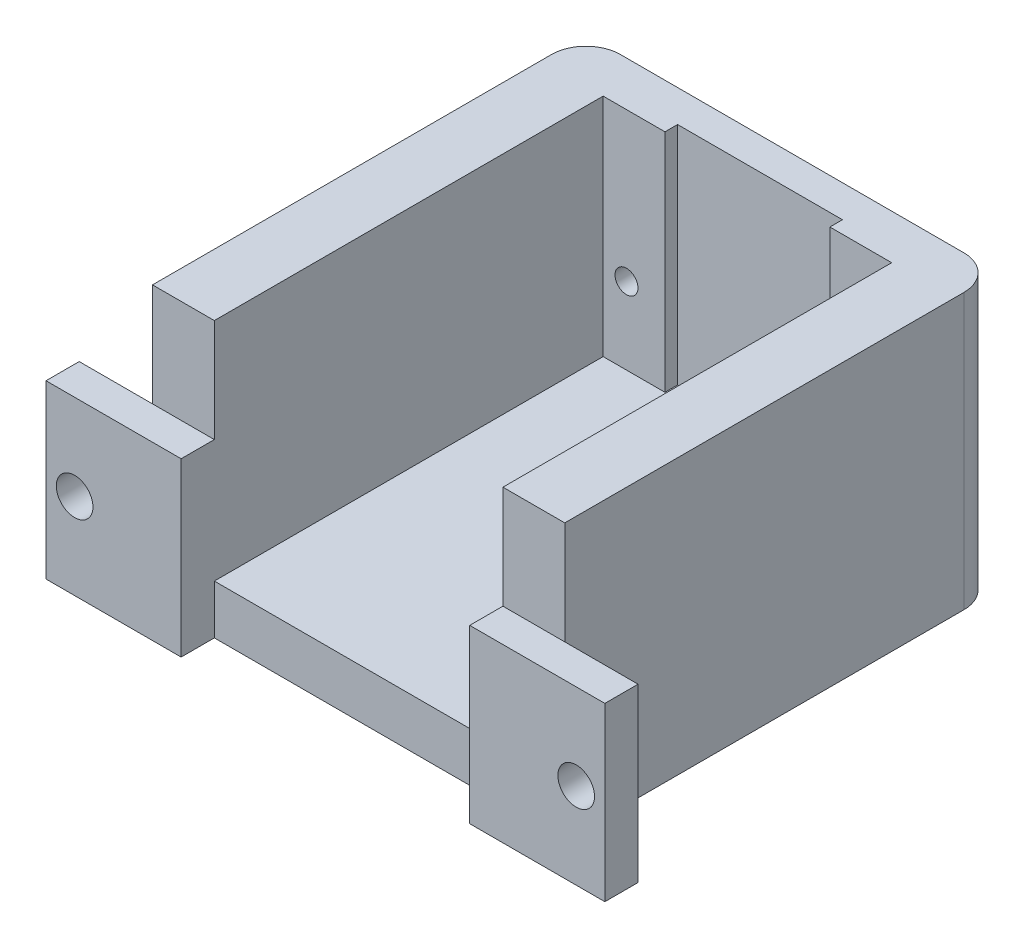
from build123d import *

# Parameters (mm, degrees)
SKETCH_3_W           = 36
SKETCH_3_H           = 50
EXTRUDE_1_DEPTH      = 24
SKETCH_4_W           = 24.8
SKETCH_4_H           = 31.8
CUT_EXTRUDE_1_DEPTH  = 19.7
SKETCH_5_W           = 14
SKETCH_5_H           = 2.2
CUT_EXTRUDE_3_DEPTH  = 19.7
SKETCH_6_W           = 18.5
SKETCH_6_H           = 3.8
CUT_EXTRUDE_4_DEPTH  = 14.7
SKETCH_7_W           = 24.8
SKETCH_7_H           = 24.280407208
CUT_EXTRUDE_5_DEPTH  = 2
SKETCH_8_R           = 2
CUT_EXTRUDE_6_DEPTH  = 6.4
SKETCH_9_R           = 1
CUT_EXTRUDE_7_DEPTH  = 6.4
SKETCH_10_R          = 2
CUT_EXTRUDE_8_DEPTH  = 7.4
SKETCH_11_R          = 1
CUT_EXTRUDE_9_DEPTH  = 7.4
SKETCH_14_W          = 47.693248889
SKETCH_14_H          = 41.94352182
CUT_EXTRUDE_12_DEPTH = 4
SKETCH_16_W          = 69.166934332
SKETCH_16_H          = 39.422219991
CUT_EXTRUDE_13_DEPTH = 5
CUT_EXTRUDE_17_DEPTH = 19.7
SKETCH_19_W          = 18.6
SKETCH_19_H          = 1.8
CUT_EXTRUDE_18_DEPTH = 12.7
SKETCH_20_W          = 66.697030433
SKETCH_20_H          = 63.084499434
CUT_EXTRUDE_19_DEPTH = 3.15
SKETCH_21_W          = 24.8
SKETCH_21_H          = 17.7
CUT_EXTRUDE_20_DEPTH = 10
SKETCH_22_W          = 12
SKETCH_22_H          = 15
SKETCH_22_R          = 1.6
EXTRUDE_2_DEPTH      = 2.9
SKETCH_23_W          = 25.2
SKETCH_23_H          = 39.225239964
CUT_EXTRUDE_22_DEPTH = 19.7
SKETCH_24_W          = 25.2
SKETCH_24_H          = 2.9
CUT_EXTRUDE_23_DEPTH = 4.3
FILLET_1_R           = 3


with BuildPart() as part:
    # 草图3 → 凸台-拉伸1 (new body)
    with BuildSketch(Plane(origin=(0, 0, 0), x_dir=(1, 0, 0), z_dir=(0, 1, 0))):
        Rectangle(SKETCH_3_W, SKETCH_3_H)
    extrude(amount=EXTRUDE_1_DEPTH)

    # 草图4 → 切除-拉伸1 (cut)
    with BuildSketch(Plane(origin=(0, 24, 0), x_dir=(1, 0, 0), z_dir=(0, 1, 0))):
        Rectangle(SKETCH_4_W, SKETCH_4_H)
    extrude(amount=-CUT_EXTRUDE_1_DEPTH, mode=Mode.SUBTRACT)

    # 草图5 → 切除-拉伸3 (cut)
    with BuildSketch(Plane(origin=(0, 24, 0), x_dir=(1, 0, 0), z_dir=(0, 1, 0))):
        with Locations((0, 15.9)):
            Rectangle(SKETCH_5_W, SKETCH_5_H)
    extrude(amount=-CUT_EXTRUDE_3_DEPTH, mode=Mode.SUBTRACT)

    # 草图6 → 切除-拉伸4 (cut)
    with BuildSketch(Plane(origin=(0, 24, 0), x_dir=(1, 0, 0), z_dir=(0, 1, 0))):
        with Locations((0, -15.9)):
            Rectangle(SKETCH_6_W, SKETCH_6_H)
    extrude(amount=-CUT_EXTRUDE_4_DEPTH, mode=Mode.SUBTRACT)

    # 草图7 → 切除-拉伸5 (cut)
    with BuildSketch(Plane(origin=(0, 24, 0), x_dir=(1, 0, 0), z_dir=(0, 1, 0))):
        with Locations((0, -25)):
            Rectangle(SKETCH_7_W, SKETCH_7_H)
    extrude(amount=-CUT_EXTRUDE_5_DEPTH, mode=Mode.SUBTRACT)

    # 草图8 → 切除-拉伸6 (cut)
    with BuildSketch(Plane.XY.offset(25)):
        with Locations((10.65, 7.2)):
            Circle(SKETCH_8_R)
        with Locations((-10.65, 7.2)):
            Circle(SKETCH_8_R)
    extrude(amount=-CUT_EXTRUDE_6_DEPTH, mode=Mode.SUBTRACT)

    # 草图9 → 切除-拉伸7 (cut)
    with BuildSketch(Plane.XY.offset(18.6)):
        with Locations((10.65, 7.2)):
            Circle(SKETCH_9_R)
        with Locations((-10.65, 7.2)):
            Circle(SKETCH_9_R)
    extrude(amount=-CUT_EXTRUDE_7_DEPTH, mode=Mode.SUBTRACT)

    # 草图10 → 切除-拉伸8 (cut)
    with BuildSketch(Plane(origin=(0, 0, -25), x_dir=(-1, 0, 0), z_dir=(0, 0, -1))):
        with Locations((-10.565, 11)):
            Circle(SKETCH_10_R)
        with Locations((10.56, 11)):
            Circle(SKETCH_10_R)
    extrude(amount=-CUT_EXTRUDE_8_DEPTH, mode=Mode.SUBTRACT)

    # 草图11 → 切除-拉伸9 (cut)
    with BuildSketch(Plane(origin=(0, 0, -17.6), x_dir=(-1, 0, 0), z_dir=(0, 0, -1))):
        with Locations((10.56, 11)):
            Circle(SKETCH_11_R)
        with Locations((-10.565, 11)):
            Circle(SKETCH_11_R)
    extrude(amount=-CUT_EXTRUDE_9_DEPTH, mode=Mode.SUBTRACT)

    # 草图14 → 切除-拉伸12 (cut)
    with BuildSketch(Plane.XY.offset(25)):
        with Locations((-2.653720185, 12.393348568)):
            Rectangle(SKETCH_14_W, SKETCH_14_H)
    extrude(amount=-CUT_EXTRUDE_12_DEPTH, mode=Mode.SUBTRACT)

    # 草图16 → 切除-拉伸13 (cut)
    with BuildSketch(Plane(origin=(0, 0, -25), x_dir=(-1, 0, 0), z_dir=(0, 0, -1))):
        with Locations((0.858826259, 12.588310345)):
            Rectangle(SKETCH_16_W, SKETCH_16_H)
    extrude(amount=-CUT_EXTRUDE_13_DEPTH, mode=Mode.SUBTRACT)

    # 草图18 → 切除-拉伸17 (cut)
    with BuildSketch(Plane(origin=(0, 24, 0), x_dir=(1, 0, 0), z_dir=(0, 1, 0))):
        Polygon((-12.6, -16.1), (12.6, -16.1), (12.6, 16.1), (7.2, 16.1), (7.2, 17.2), (-7.2, 17.2), (-7.2, 16.1), (-12.6, 16.1), align=None)
    extrude(amount=-CUT_EXTRUDE_17_DEPTH, mode=Mode.SUBTRACT)

    # 草图19 → 切除-拉伸18 (cut)
    with BuildSketch(Plane(origin=(0, 22, 0), x_dir=(1, 0, 0), z_dir=(0, 1, 0))):
        with Locations((0, -16.95)):
            Rectangle(SKETCH_19_W, SKETCH_19_H)
    extrude(amount=-CUT_EXTRUDE_18_DEPTH, mode=Mode.SUBTRACT)

    # 草图20 → 切除-拉伸19 (cut)
    with BuildSketch(Plane.XY.offset(21)):
        with Locations((4.746063078, 3.342697103)):
            Rectangle(SKETCH_20_W, SKETCH_20_H)
    extrude(amount=-CUT_EXTRUDE_19_DEPTH, mode=Mode.SUBTRACT)

    # 草图21 → 切除-拉伸20 (cut)
    with BuildSketch(Plane.XY.offset(17.85)):
        with Locations((0, 13.15)):
            Rectangle(SKETCH_21_W, SKETCH_21_H)
    extrude(amount=-CUT_EXTRUDE_20_DEPTH, mode=Mode.SUBTRACT)

    # 草图22 → 凸台-拉伸2 (add)
    with BuildSketch(Plane.XY.offset(17.85)):
        with Locations((18.4, 7.5)):
            Rectangle(SKETCH_22_W, SKETCH_22_H)
        with Locations((21.9, 7.5)):
            Circle(SKETCH_22_R, mode=Mode.SUBTRACT)
    extrude_2 = extrude(amount=EXTRUDE_2_DEPTH)

    # 镜向1: 凸台-拉伸2 across plane
    add(extrude_2.mirror(Plane(origin=(0, 0, 0), x_dir=(0, 0, 1), z_dir=(1, 0, 0))))

    # 草图23 → 切除-拉伸22 (cut)
    with BuildSketch(Plane(origin=(0, 24, 0), x_dir=(1, 0, 0), z_dir=(0, 1, 0))):
        with Locations((0, -3.512619982)):
            Rectangle(SKETCH_23_W, SKETCH_23_H)
    extrude(amount=-CUT_EXTRUDE_22_DEPTH, mode=Mode.SUBTRACT)

    # 草图24 → 切除-拉伸23 (cut)
    with BuildSketch(Plane(origin=(0, 4.3, 0), x_dir=(1, 0, 0), z_dir=(0, 1, 0))):
        with Locations((0, -19.3)):
            Rectangle(SKETCH_24_W, SKETCH_24_H)
    extrude(amount=-CUT_EXTRUDE_23_DEPTH, mode=Mode.SUBTRACT)

    # 圆角1
    fillet_1_edges = [part.edges().sort_by_distance(p)[0] for p in [
        (-18, 12, -20),
        (18, 12, -20),
    ]]
    fillet(fillet_1_edges, radius=FILLET_1_R)


solid = part.part
